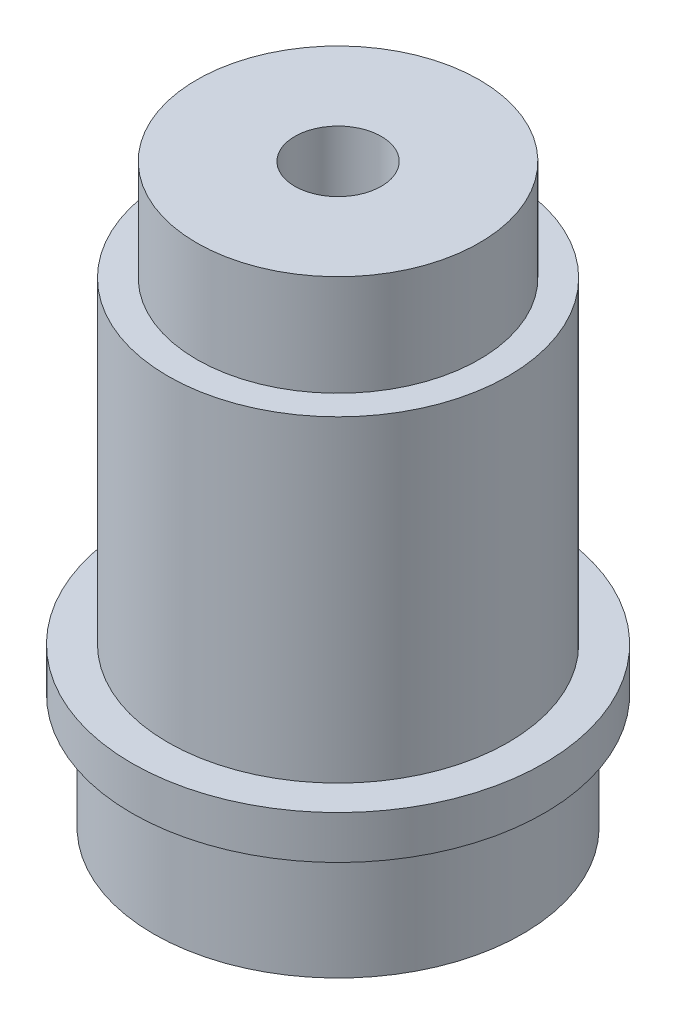
from build123d import *

# Parameters (mm, degrees)
SKETCH_1_R          = 6.4
EXTRUDE_1_DEPTH     = 4
SKETCH_2_R          = 7.15
EXTRUDE_2_DEPTH     = 1.5
SKETCH_3_R          = 5.9
EXTRUDE_3_DEPTH     = 11
SKETCH_4_R          = 4.9
EXTRUDE_4_DEPTH     = 3.5
SKETCH_5_R          = 5
CUT_EXTRUDE_1_DEPTH = 15
SKETCH_6_R          = 1.5
CUT_EXTRUDE_2_DEPTH = 5


with BuildPart() as part:
    # ｽｹｯﾁ1 → ﾎﾞｽ - 押し出し1 (new body)
    with BuildSketch(Plane(origin=(0, 0, 0), x_dir=(1, 0, 0), z_dir=(0, 1, 0))):
        with Locations(Location((0, 0, 0), (0, 0, 270))):
            Circle(SKETCH_1_R)
    extrude(amount=EXTRUDE_1_DEPTH)

    # ｽｹｯﾁ2 → ﾎﾞｽ - 押し出し2 (add)
    with BuildSketch(Plane(origin=(0, 4, 0), x_dir=(1, 0, 0), z_dir=(0, 1, 0))):
        with Locations(Location((0, 0, 0), (0, 0, 270))):
            Circle(SKETCH_2_R)
    extrude(amount=EXTRUDE_2_DEPTH)

    # ｽｹｯﾁ3 → ﾎﾞｽ - 押し出し3 (add)
    with BuildSketch(Plane(origin=(0, 5.5, 0), x_dir=(1, 0, 0), z_dir=(0, 1, 0))):
        with Locations(Location((0, 0, 0), (0, 0, 270))):
            Circle(SKETCH_3_R)
    extrude(amount=EXTRUDE_3_DEPTH)

    # ｽｹｯﾁ4 → ﾎﾞｽ - 押し出し4 (add)
    with BuildSketch(Plane(origin=(0, 16.5, 0), x_dir=(1, 0, 0), z_dir=(0, 1, 0))):
        with Locations(Location((0, 0, 0), (0, 0, 270))):
            Circle(SKETCH_4_R)
    extrude(amount=EXTRUDE_4_DEPTH)

    # ｽｹｯﾁ5 → ｶｯﾄ - 押し出し1 (cut)
    with BuildSketch(Plane(origin=(0, 0, 0), x_dir=(-1, 0, 0), z_dir=(0, -1, 0))):
        with Locations(Location((0, 0, 0), (0, 0, 90))):
            Circle(SKETCH_5_R)
    extrude(amount=-CUT_EXTRUDE_1_DEPTH, mode=Mode.SUBTRACT)

    # ｽｹｯﾁ6 → ｶｯﾄ - 押し出し2 (cut)
    with BuildSketch(Plane(origin=(0, 20, 0), x_dir=(1, 0, 0), z_dir=(0, 1, 0))):
        with Locations(Location((0, 0, 0), (0, 0, 270))):
            Circle(SKETCH_6_R)
    extrude(amount=-CUT_EXTRUDE_2_DEPTH, mode=Mode.SUBTRACT)


solid = part.part
